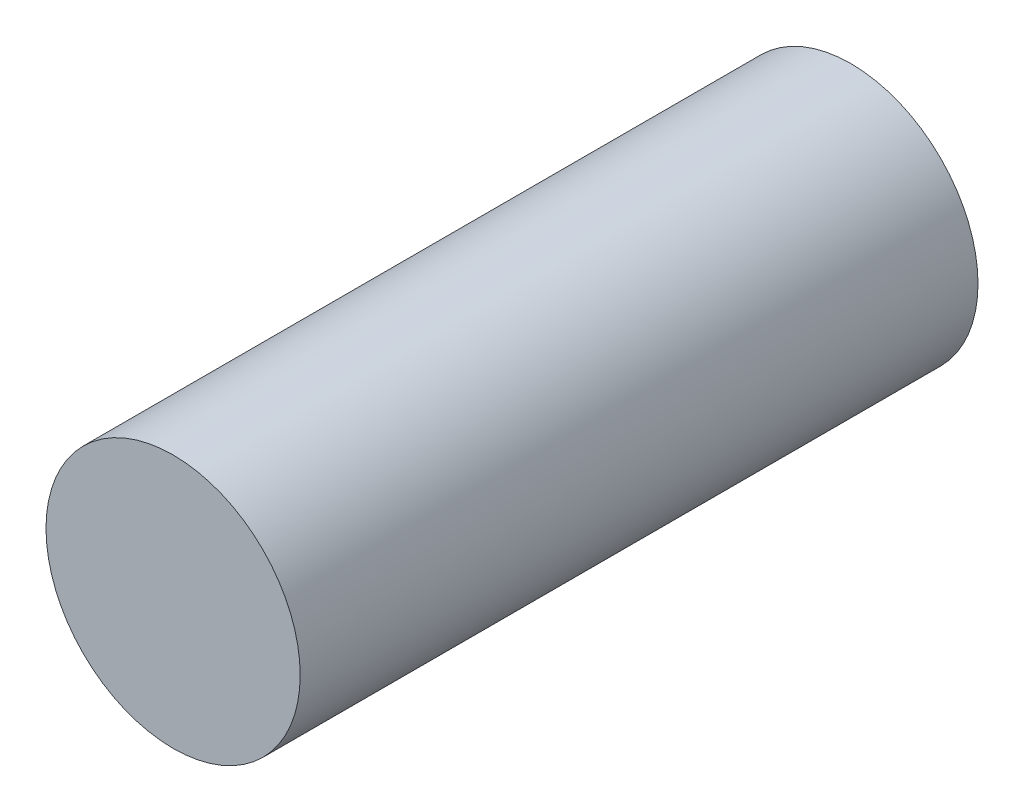
from build123d import *

# Parameters (mm, degrees)
SKETCH1_R           = 76.2
BOSS_EXTRUDE1_DEPTH = 406.4


with BuildPart() as part:
    # Sketch1 → Boss-Extrude1 (new body)
    with BuildSketch(Plane.XY):
        Circle(SKETCH1_R)
    extrude(amount=BOSS_EXTRUDE1_DEPTH)


solid = part.part
